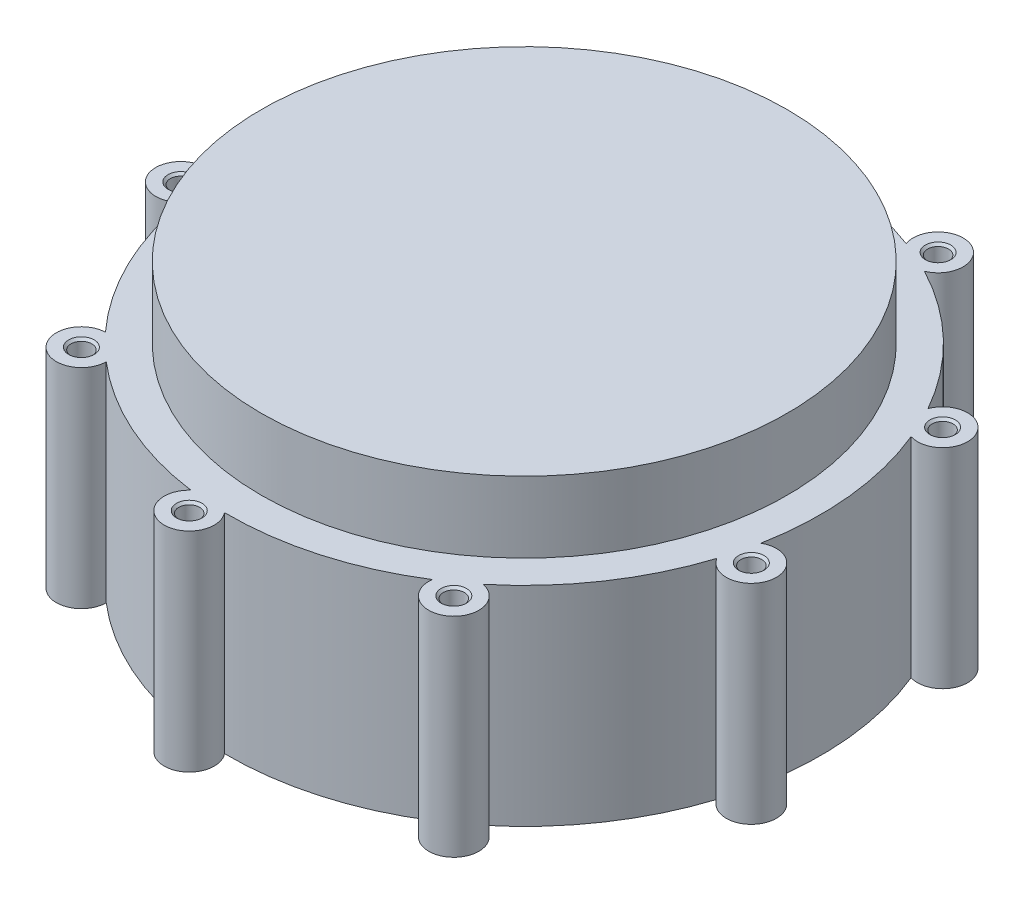
from build123d import *

# Parameters (mm, degrees)
SKETCH_1_R                   = 3
SKETCH_1_R_2                 = 35.5
EXTRUDE_1_DEPTH              = 25
HOLE_WIZARD_M3_1_D           = 2.5
HOLE_WIZARD_M3_1_DEPTH       = 8
HOLE_WIZARD_M3_1_CSINK_D     = 3.05
HOLE_WIZARD_M3_1_CSINK_ANGLE = 90
HOLE_WIZARD_M3_1_TIP         = 0.751075774
SKETCH_7_R                   = 21.5
SKETCH_7_R_2                 = 18
EXTRUDE_3_DEPTH              = 2
CUT_EXTRUDE_START            = -5
SKETCH_8_R                   = 18
CUT_EXTRUDE_2_DEPTH          = 5
SKETCH_9_R                   = 2
CUT_EXTRUDE_3_DEPTH          = 1
SKETCH_11_R                  = 31.5
EXTRUDE_4_DEPTH              = 8.5
HOLE_WIZARD_M3_4_D           = 2.5
HOLE_WIZARD_M3_4_DEPTH       = 8
HOLE_WIZARD_M3_4_CSINK_D     = 3.05
HOLE_WIZARD_M3_4_CSINK_ANGLE = 90
HOLE_WIZARD_M3_4_TIP         = 0.751075774


with BuildPart() as part:
    # 草图1 → 凸台-拉伸1 (new body)
    with BuildSketch(Plane(origin=(0, 0, 0), x_dir=(1, 0, 0), z_dir=(0, 1, 0))):
        with Locations((-31.034181612, 21.050643022)):
            Circle(SKETCH_1_R)
        Circle(SKETCH_1_R_2)
        with Locations((-37.304654882, -3.822659306)):
            Circle(SKETCH_1_R)
        with Locations((-26.119865536, -26.907296861)):
            Circle(SKETCH_1_R)
        with Locations((-2.713300817, -37.401711173)):
            Circle(SKETCH_1_R)
        with Locations((21.96284751, -30.395449154)):
            Circle(SKETCH_1_R)
        with Locations((36.362335397, -9.166818668)):
            Circle(SKETCH_1_R)
        with Locations((33.747482429, 16.351068151)):
            Circle(SKETCH_1_R)
        with Locations((15.341807372, 34.21810846)):
            Circle(SKETCH_1_R)
        with Locations((-10.24246986, 36.074115528)):
            Circle(SKETCH_1_R)
        Circle(SKETCH_1_R_2)
        with Locations((-37.304654882, -3.822659306)):
            Circle(SKETCH_1_R)
        Circle(SKETCH_1_R_2)
        with Locations((-37.304654882, -3.822659306)):
            Circle(SKETCH_1_R)
        Circle(SKETCH_1_R_2)
        with Locations((-26.119865536, -26.907296861)):
            Circle(SKETCH_1_R)
        Circle(SKETCH_1_R_2)
        with Locations((-26.119865536, -26.907296861)):
            Circle(SKETCH_1_R)
        Circle(SKETCH_1_R_2)
        with Locations((-2.713300817, -37.401711173)):
            Circle(SKETCH_1_R)
        Circle(SKETCH_1_R_2)
        with Locations((-2.713300817, -37.401711173)):
            Circle(SKETCH_1_R)
        Circle(SKETCH_1_R_2)
        with Locations((21.96284751, -30.395449154)):
            Circle(SKETCH_1_R)
        Circle(SKETCH_1_R_2)
        with Locations((21.96284751, -30.395449154)):
            Circle(SKETCH_1_R)
        Circle(SKETCH_1_R_2)
        with Locations((36.362335397, -9.166818668)):
            Circle(SKETCH_1_R)
        Circle(SKETCH_1_R_2)
        with Locations((36.362335397, -9.166818668)):
            Circle(SKETCH_1_R)
        Circle(SKETCH_1_R_2)
        with Locations((33.747482429, 16.351068151)):
            Circle(SKETCH_1_R)
        Circle(SKETCH_1_R_2)
        with Locations((33.747482429, 16.351068151)):
            Circle(SKETCH_1_R)
        Circle(SKETCH_1_R_2)
        with Locations((15.341807372, 34.21810846)):
            Circle(SKETCH_1_R)
        Circle(SKETCH_1_R_2)
        with Locations((15.341807372, 34.21810846)):
            Circle(SKETCH_1_R)
        Circle(SKETCH_1_R_2)
        with Locations((-10.24246986, 36.074115528)):
            Circle(SKETCH_1_R)
        Circle(SKETCH_1_R_2)
        with Locations((-10.24246986, 36.074115528)):
            Circle(SKETCH_1_R)
        Circle(SKETCH_1_R_2)
        with Locations((-31.034181612, 21.050643022)):
            Circle(SKETCH_1_R)
        Circle(SKETCH_1_R_2)
        with Locations((-31.034181612, 21.050643022)):
            Circle(SKETCH_1_R)
    extrude(amount=EXTRUDE_1_DEPTH)

    # M3 螺纹孔1
    with Locations(Plane(origin=(-26.119865536, 0, 26.907296861), x_dir=(0, 0, -1), z_dir=(0, -1, 0))):
        with Locations((0, 0), (-10.494414312, 23.406564719), (-3.488152293, 48.082713046), (17.740478193, 62.482200933), (43.258365012, 59.867347965), (61.125405321, 41.461672908), (62.981412389, 15.877395676), (47.957939883, -4.914316076), (23.084637555, -11.184789346)):
            CounterSinkHole(HOLE_WIZARD_M3_1_D / 2, HOLE_WIZARD_M3_1_CSINK_D / 2, depth=HOLE_WIZARD_M3_1_DEPTH, counter_sink_angle=HOLE_WIZARD_M3_1_CSINK_ANGLE)
            with Locations((0, 0, -(HOLE_WIZARD_M3_1_DEPTH + HOLE_WIZARD_M3_1_TIP / 2))):  # 118° drill point
                Cone(0, HOLE_WIZARD_M3_1_D / 2, HOLE_WIZARD_M3_1_TIP, mode=Mode.SUBTRACT)

    # 草图7 → 凸台-拉伸3 (add)
    with BuildSketch(Plane.XZ):
        with Locations(Location((0, 0, 0), (0, 0, 90))):
            Circle(SKETCH_7_R)
        with Locations(Location((0, 0, 0), (0, 0, 270))):
            Circle(SKETCH_7_R_2, mode=Mode.SUBTRACT)
    extrude(amount=EXTRUDE_3_DEPTH)

    # 草图8 → 切除-拉伸2 (cut)
    with BuildSketch(Plane.XZ.offset(CUT_EXTRUDE_START)):
        with Locations(Location((0, 0, 0), (0, 0, 270))):
            Circle(SKETCH_8_R)
    extrude(amount=CUT_EXTRUDE_2_DEPTH, mode=Mode.SUBTRACT)

    # 草图9 → 切除-拉伸3 (cut)
    with BuildSketch(Plane.XZ.offset(-5)):
        with Locations(Location((0, 0, 0), (0, 0, 270))):
            Circle(SKETCH_9_R)
    extrude(amount=-CUT_EXTRUDE_3_DEPTH, mode=Mode.SUBTRACT)

    # 草图11 → 凸台-拉伸4 (add)
    with BuildSketch(Plane(origin=(0, 25, 0), x_dir=(1, 0, 0), z_dir=(0, 1, 0))):
        with Locations(Location((0, 0, 0), (0, 0, 270))):
            Circle(SKETCH_11_R)
    extrude(amount=EXTRUDE_4_DEPTH)

    # M3 螺纹孔4
    with Locations(Plane(origin=(0, 25, 0), x_dir=(1, 0, 0), z_dir=(0, 1, 0))):
        with Locations((-31.034181612, 21.050643022), (-37.304654882, -3.822659306), (-26.119865536, -26.907296861), (-2.713300817, -37.401711173), (21.96284751, -30.395449154), (36.362335397, -9.166818668), (33.747482429, 16.351068151), (15.341807372, 34.21810846), (-10.24246986, 36.074115528)):
            CounterSinkHole(HOLE_WIZARD_M3_4_D / 2, HOLE_WIZARD_M3_4_CSINK_D / 2, depth=HOLE_WIZARD_M3_4_DEPTH, counter_sink_angle=HOLE_WIZARD_M3_4_CSINK_ANGLE)
            with Locations((0, 0, -(HOLE_WIZARD_M3_4_DEPTH + HOLE_WIZARD_M3_4_TIP / 2))):  # 118° drill point
                Cone(0, HOLE_WIZARD_M3_4_D / 2, HOLE_WIZARD_M3_4_TIP, mode=Mode.SUBTRACT)


solid = part.part
